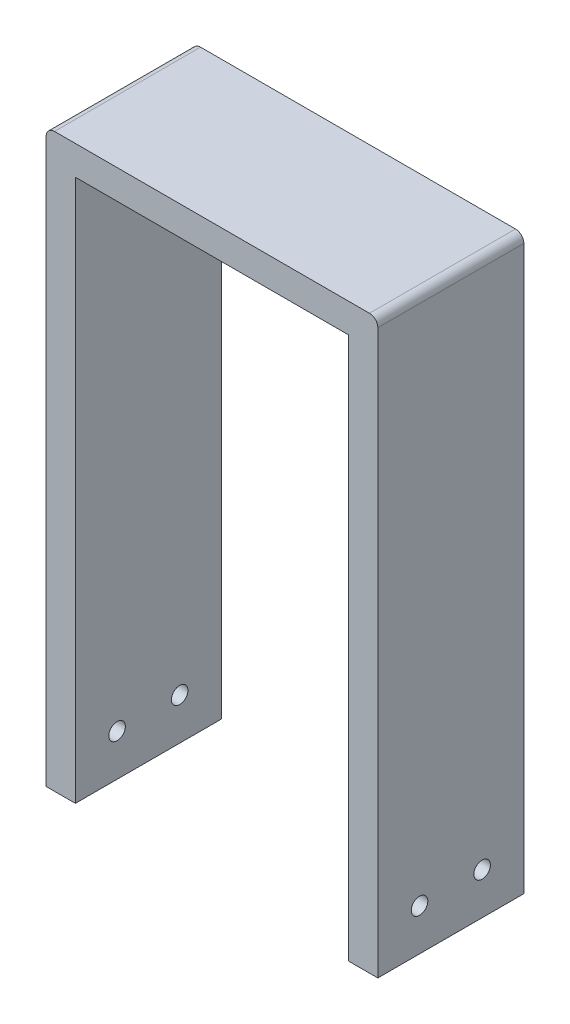
from build123d import *

# Parameters (mm, degrees)
BOSS_EXTRUDE1_DEPTH     = 17.5
CUT_EXTRUDE1_DEPTH      = 85.085150294
CUT_EXTRUDE1_DEPTH_BACK = 85.085150294
SKETCH2_R               = 1.98501
FILLET1_R               = 2


with BuildPart() as part:
    # Sketch1 → Boss-Extrude1 (new, symmetric)
    with BuildSketch(Plane.XY):
        Polygon((-39.75, -65), (-39.75, 72), (39.75, 72), (39.75, -65), (32.75, -65), (32.75, 65), (-32.75, 65), (-32.75, -65), align=None)
    extrude(amount=BOSS_EXTRUDE1_DEPTH, both=True)

    # Sketch2 → Cut-Extrude1 (cut, two sides: drawn at the far end of the back side and taken through both)
    with BuildSketch(Plane(origin=(0, 0, 0), x_dir=(0, 0, -1), z_dir=(1, 0, 0)).offset(-CUT_EXTRUDE1_DEPTH_BACK)):
        with Locations((-7.5, -55)):
            Circle(SKETCH2_R)
        with Locations((7.5, -55)):
            Circle(SKETCH2_R)
    extrude(amount=CUT_EXTRUDE1_DEPTH + CUT_EXTRUDE1_DEPTH_BACK, mode=Mode.SUBTRACT)

    # Fillet1
    fillet1_edges = [part.edges().sort_by_distance(p)[0] for p in [
        (-39.75, 72, 0),
        (39.75, 72, 0),
    ]]
    fillet(fillet1_edges, radius=FILLET1_R)


solid = part.part
